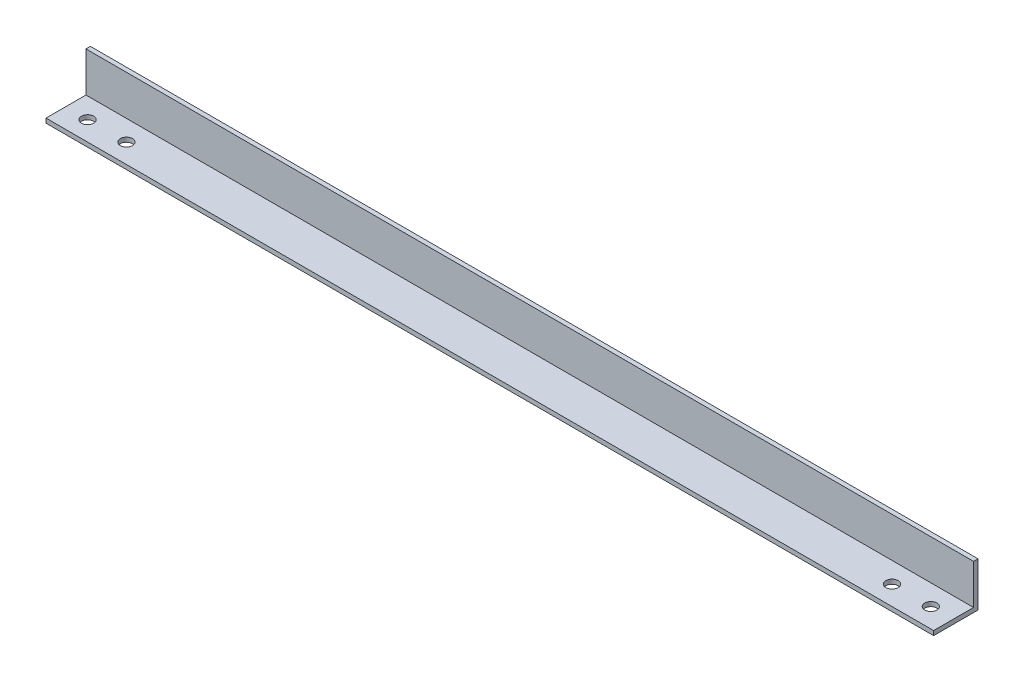
from build123d import *

# Parameters (mm, degrees)
SKETCH_263_W        = 1600
SKETCH_263_H        = 80
EXTRUDE_4_DEPTH     = 8
SKETCH_3_W          = 1600
SKETCH_3_H          = 8
EXTRUDE_5_DEPTH     = 72
SKETCH_4_R          = 11
CUT_EXTRUDE_2_DEPTH = 1604.615914114


with BuildPart() as part:
    # Sketch 263 → 拉伸4 (new body)
    with BuildSketch(Plane.XY):
        with Locations((800, 40)):
            Rectangle(SKETCH_263_W, SKETCH_263_H)
    extrude(amount=EXTRUDE_4_DEPTH)

    # 草图3 → 拉伸5 (add)
    with BuildSketch(Plane.XY.offset(8)):
        with Locations((800, 4)):
            Rectangle(SKETCH_3_W, SKETCH_3_H)
    extrude(amount=EXTRUDE_5_DEPTH)

    # 草图4 → 切除-拉伸2 (cut, through all)
    with BuildSketch(Plane(origin=(0, 8, 0), x_dir=(1, 0, 0), z_dir=(0, 1, 0))):
        with Locations(Location((40, -45, 0), (0, 0, 270))):
            Circle(SKETCH_4_R)
        with Locations(Location((110, -45, 0), (0, 0, 270))):
            Circle(SKETCH_4_R)
        with Locations(Location((1490, -45, 0), (0, 0, 270))):
            Circle(SKETCH_4_R)
        with Locations(Location((1560, -45, 0), (0, 0, 270))):
            Circle(SKETCH_4_R)
    extrude(amount=-CUT_EXTRUDE_2_DEPTH, mode=Mode.SUBTRACT)


solid = part.part
